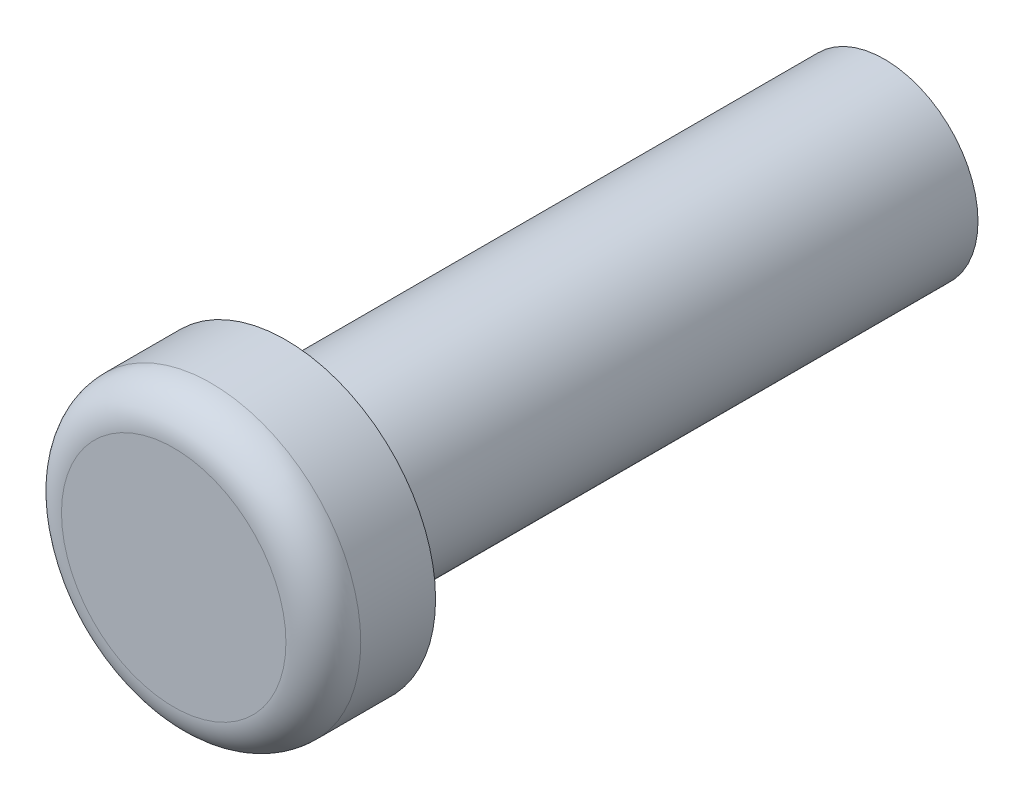
from build123d import *

# Parameters (mm, degrees)
SKETCH1_R           = 2.5
BOSS_EXTRUDE1_DEPTH = 16
SKETCH2_R           = 4
BOSS_EXTRUDE2_DEPTH = 3
FILLET1_R           = 1


with BuildPart() as part:
    # Sketch1 → Boss-Extrude1 (new body)
    with BuildSketch(Plane.XY):
        with Locations((-20, -30)):
            Circle(SKETCH1_R)
    extrude(amount=-BOSS_EXTRUDE1_DEPTH)

    # Sketch2 → Boss-Extrude2 (add)
    with BuildSketch(Plane.XY):
        with Locations((-20, -30)):
            Circle(SKETCH2_R)
    extrude(amount=BOSS_EXTRUDE2_DEPTH)

    # Fillet1
    fillet1_edges = [part.edges().sort_by_distance(p)[0] for p in [
        (-24, -30, 3),
    ]]
    fillet(fillet1_edges, radius=FILLET1_R)


solid = part.part
